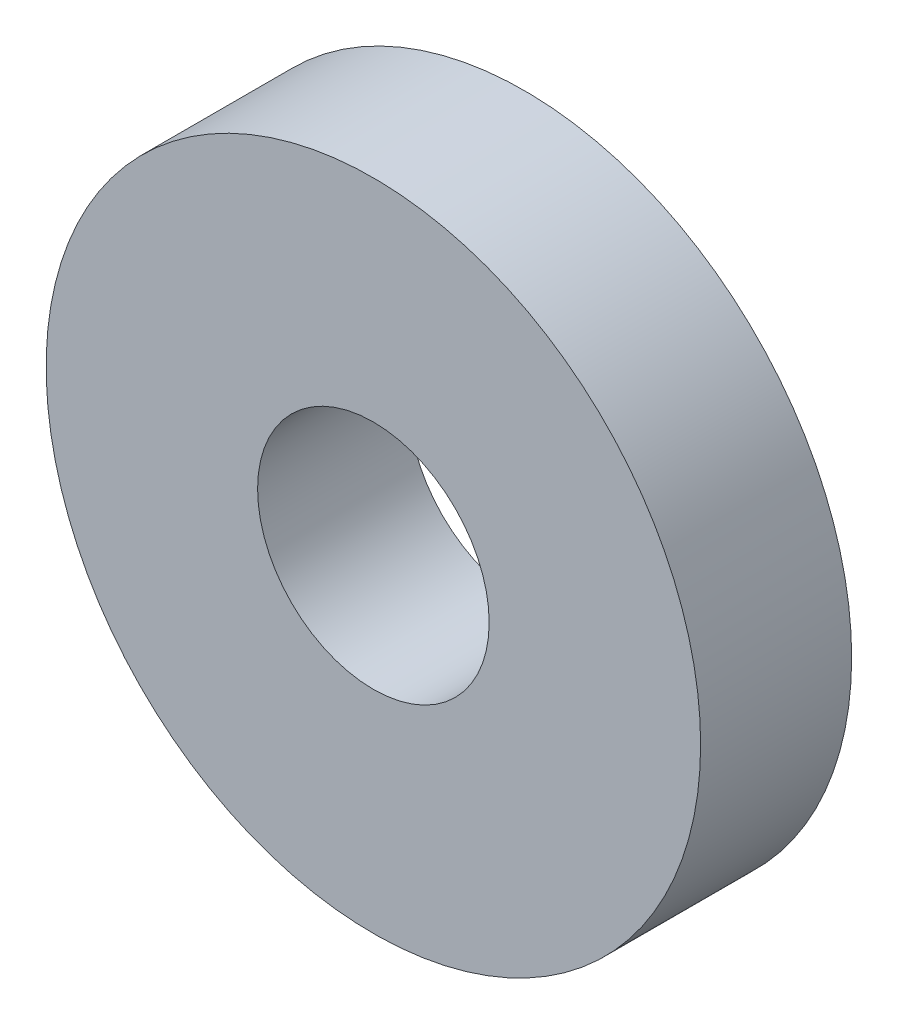
from build123d import *

# Parameters (mm, degrees)
SKETCH1_R           = 9.75
BOSS_EXTRUDE1_DEPTH = 4.5
SKETCH2_R           = 3.45
CUT_EXTRUDE1_DEPTH  = 4.5


with BuildPart() as part:
    # Sketch1 → Boss-Extrude1 (new body)
    with BuildSketch(Plane.XY):
        Circle(SKETCH1_R)
    extrude(amount=BOSS_EXTRUDE1_DEPTH)

    # Sketch2 → Cut-Extrude1 (cut)
    with BuildSketch(Plane.XY.offset(4.5)):
        Circle(SKETCH2_R)
    extrude(amount=-CUT_EXTRUDE1_DEPTH, mode=Mode.SUBTRACT)


solid = part.part
